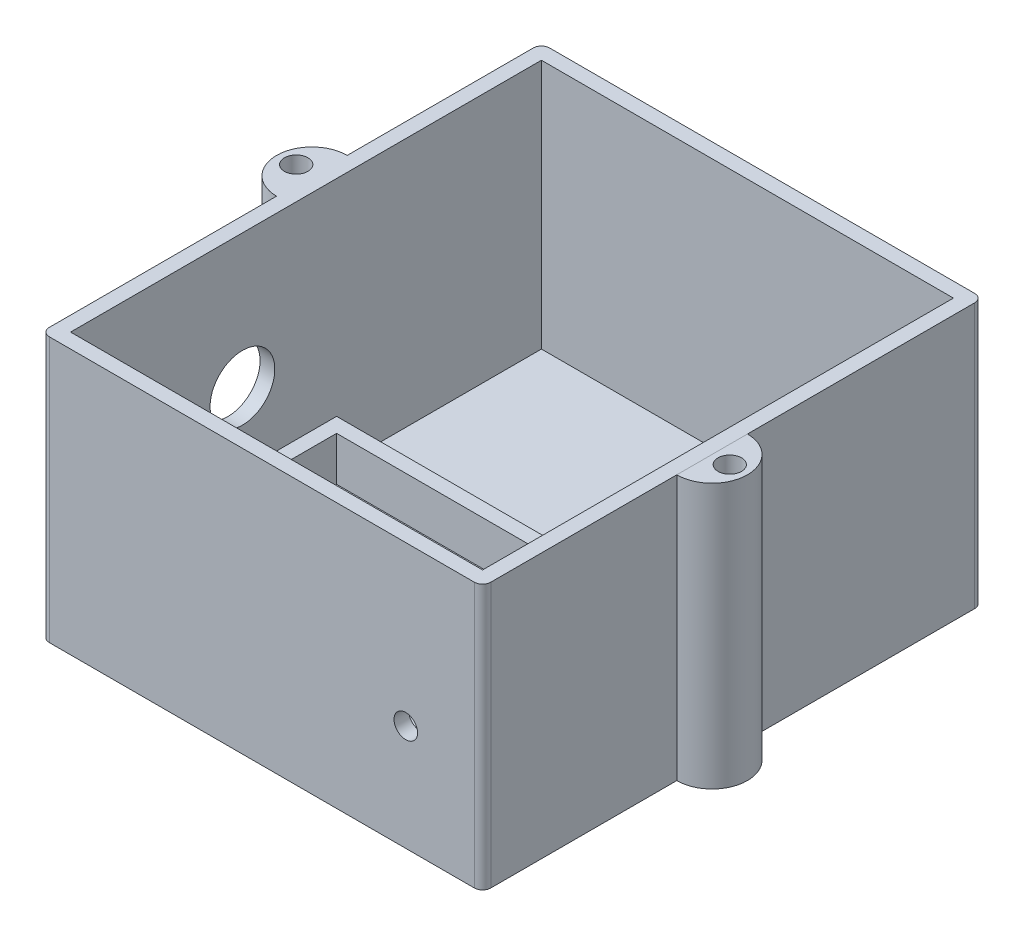
from build123d import *

# Parameters (mm, degrees)
SKETCH1_W           = 95.25
SKETCH1_H           = 107.95
BOSS_EXTRUDE1_DEPTH = 3.175
SKETCH1_3_W         = 95.25
SKETCH1_3_H         = 107.95
SKETCH1_3_W_2       = 88.9
SKETCH1_3_H_2       = 101.6
BOSS_EXTRUDE2_DEPTH = 57.15
SKETCH3_R           = 2.54
CUT_EXTRUDE1_DEPTH  = 12.7
FILLET1_R           = 1.778
SKETCH5_W           = 7.62
SKETCH5_H           = 57.15
REVOLVE1_ANGLE      = 180
SKETCH6_W           = 7.62
SKETCH6_H           = 57.15
REVOLVE2_ANGLE      = 180
SKETCH7_R           = 2.54
CUT_EXTRUDE2_DEPTH  = 160.69208465
SKETCH9_R           = 2.54
CUT_EXTRUDE3_DEPTH  = 160.69208465
SKETCH10_W          = 87.884
SKETCH10_H          = 57.404
SKETCH10_W_2        = 81.534
SKETCH10_H_2        = 51.054
BOSS_EXTRUDE3_DEPTH = 9.525
SKETCH11_W          = 50.8
SKETCH11_H          = 3.175
BOSS_EXTRUDE4_DEPTH = 7.62
SKETCH12_R          = 6.985
CUT_EXTRUDE4_DEPTH  = 7.62


with BuildPart() as part:
    # Sketch1 → Boss-Extrude1 (new body)
    with BuildSketch(Plane(origin=(0, 0, 0), x_dir=(1, 0, 0), z_dir=(0, 1, 0))):
        with Locations((-47.625, -53.975)):
            Rectangle(SKETCH1_W, SKETCH1_H)
    extrude(amount=BOSS_EXTRUDE1_DEPTH)

    # Sketch1<3> → Boss-Extrude2 (add)
    with BuildSketch(Plane(origin=(0, 0, 0), x_dir=(1, 0, 0), z_dir=(0, 1, 0))):
        with Locations((-47.625, -53.975)):
            Rectangle(SKETCH1_3_W, SKETCH1_3_H)
        with Locations((-47.625, -53.975)):
            Rectangle(SKETCH1_3_W_2, SKETCH1_3_H_2, mode=Mode.SUBTRACT)
    extrude(amount=BOSS_EXTRUDE2_DEPTH)

    # Sketch3 → Cut-Extrude1 (cut)
    with BuildSketch(Plane.XY.offset(107.95)):
        with Locations((-16.566148484, 22.86)):
            Circle(SKETCH3_R)
    extrude(amount=-CUT_EXTRUDE1_DEPTH, mode=Mode.SUBTRACT)

    # Fillet1
    fillet1_edges = [part.edges().sort_by_distance(p)[0] for p in [
        (-95.25, 28.575, 0),
        (0, 28.575, 0),
        (0, 28.575, 107.95),
        (-95.25, 28.575, 107.95),
    ]]
    fillet(fillet1_edges, radius=FILLET1_R)

    # Sketch6 → Revolve2 (revolve)
    with BuildSketch(Plane.ZY.offset(95.25)):
        with Locations((53.34, 28.575)):
            Rectangle(SKETCH6_W, SKETCH6_H)
    revolve(axis=Axis((-95.25, 57.15, 49.53), (0, -1, 0)), revolution_arc=REVOLVE2_ANGLE)

    # Sketch7 → Cut-Extrude2 (cut, through all)
    with BuildSketch(Plane(origin=(0, 57.15, 0), x_dir=(1, 0, 0), z_dir=(0, 1, 0))):
        with Locations((-99.038975602, -49.13029525)):
            Circle(SKETCH7_R)
    extrude(amount=-CUT_EXTRUDE2_DEPTH, mode=Mode.SUBTRACT)

    # Sketch10 → Boss-Extrude3 (add)
    with BuildSketch(Plane(origin=(0, 3.175, 0), x_dir=(1, 0, 0), z_dir=(0, 1, 0))):
        with Locations((-48.133, -76.073)):
            Rectangle(SKETCH10_W, SKETCH10_H)
        with Locations((-48.133, -76.073)):
            Rectangle(SKETCH10_W_2, SKETCH10_H_2, mode=Mode.SUBTRACT)
    extrude(amount=BOSS_EXTRUDE3_DEPTH)

    # Sketch11 → Boss-Extrude4 (add)
    with BuildSketch(Plane(origin=(0, 3.175, 0), x_dir=(1, 0, 0), z_dir=(0, 1, 0))):
        with Locations((-48.133, -76.073)):
            Rectangle(SKETCH11_W, SKETCH11_H)
    extrude(amount=BOSS_EXTRUDE4_DEPTH)

    # Sketch12 → Cut-Extrude4 (cut)
    with BuildSketch(Plane.ZY.offset(95.25)):
        with Locations((67.691, 28.194)):
            Circle(SKETCH12_R)
    extrude(amount=-CUT_EXTRUDE4_DEPTH, mode=Mode.SUBTRACT)


with BuildPart() as body_2:
    # Sketch5 → Revolve1 (revolve)
    with BuildSketch(Plane(origin=(0, 0, 0), x_dir=(0, 0, -1), z_dir=(1, 0, 0))):
        with Locations((-62.23, 28.575)):
            Rectangle(SKETCH5_W, SKETCH5_H)
    revolve(axis=Axis((0, 57.15, 58.42), (0, 1, 0)), revolution_arc=REVOLVE1_ANGLE)

    # Sketch9 → Cut-Extrude3 (cut, through all)
    with BuildSketch(Plane(origin=(0, 57.15, 0), x_dir=(1, 0, 0), z_dir=(0, 1, 0))):
        with Locations((3.81, -58.42)):
            Circle(SKETCH9_R)
    extrude(amount=-CUT_EXTRUDE3_DEPTH, mode=Mode.SUBTRACT)


solid = Compound([part.part, body_2.part])
